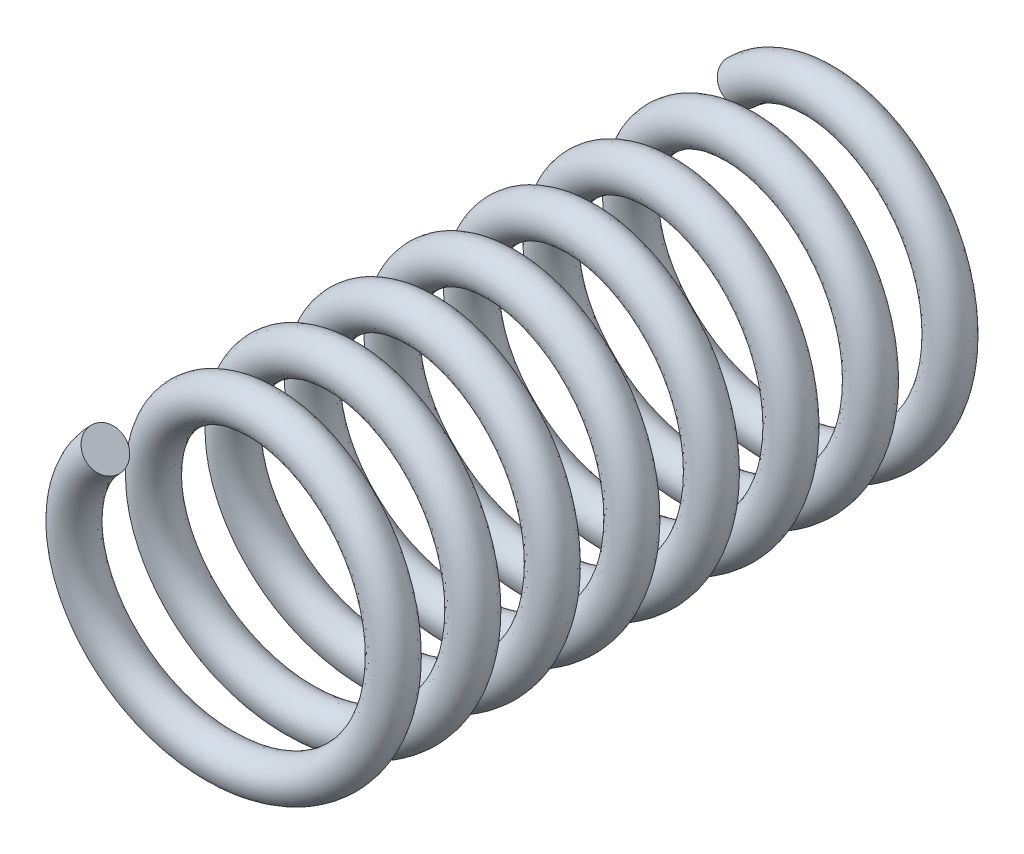
from build123d import *

# Parameters (mm, degrees)
SWEEP1_PITCH       = 1
SWEEP1_HEIGHT      = 8
SWEEP1_RADIUS      = 1.75
SWEEP1_START_ANGLE = 135
SKETCH2_R          = 0.25


with BuildPart() as part:
    # Sweep1: sweep along a helix
    with BuildLine() as sweep1_path:
        add(Helix(SWEEP1_PITCH, SWEEP1_HEIGHT, SWEEP1_RADIUS, center=(0, 0, 0), direction=(0, 0, 1), lefthand=True, mode=Mode.PRIVATE).rotate(Axis((0, 0, 0), (0, 0, 1)), SWEEP1_START_ANGLE))
    # Sketch2 → Sweep1 (sweep)
    with BuildSketch(Plane(origin=(0, 0, 0), x_dir=(0, 0, -1), z_dir=(1, 0, 0))):
        with Locations((-6.624999987, -1.75)):
            Circle(SKETCH2_R)
    sweep(path=sweep1_path.line, is_frenet=True)


solid = part.part
